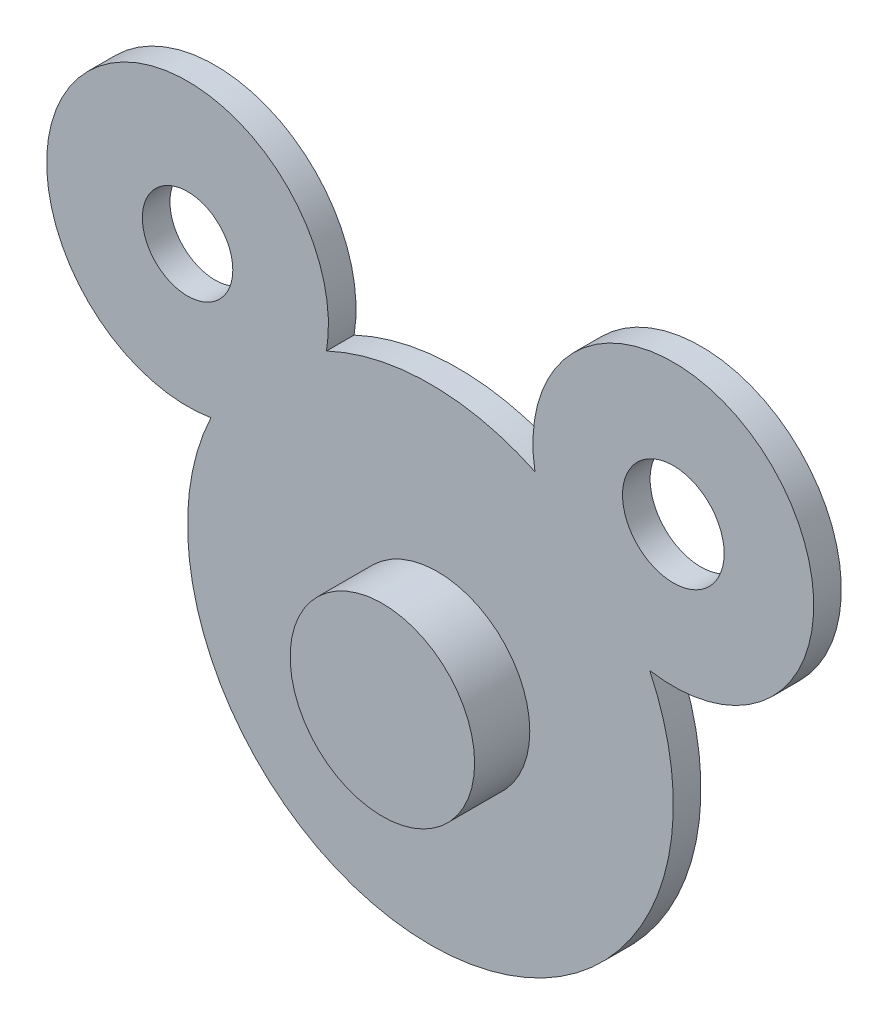
from build123d import *

# Parameters (mm, degrees)
SKETCH1_R           = 8.332963545
SKETCH1_R_2         = 9.35840883
BOSS_EXTRUDE2_DEPTH = 5.08
SKETCH2_R           = 16.987426911
BOSS_EXTRUDE3_DEPTH = 10.16
SKETCH2_3_R         = 7.512157001
CUT_EXTRUDE1_DEPTH  = 10.16
SKETCH2_4_R         = 16.987426911
SKETCH2_4_R_2       = 7.512157001
BOSS_EXTRUDE4_DEPTH = 10.16


with BuildPart() as part:
    # Sketch1 → Boss-Extrude2 (new body)
    with BuildSketch(Plane.XY):
        with BuildLine():
            ThreePointArc((-40.42750083, 19.142632152), (0.054998173, -44.730528326), (40.380305232, 19.241988943))
            ThreePointArc((40.380305232, 19.241988943), (63.014326775, 63.014326775), (19.241988943, 40.380305232))
            ThreePointArc((19.241988943, 40.380305232), (0.054998173, 44.730528326), (-19.142632152, 40.42750083))
            ThreePointArc((-19.142632152, 40.42750083), (-63.078021056, 63.078021056), (-40.42750083, 19.142632152))
        make_face()
        with Locations((-44.730562137, 44.730562137)):
            Circle(SKETCH1_R, mode=Mode.SUBTRACT)
        with Locations((44.730562137, 44.730562137)):
            Circle(SKETCH1_R_2, mode=Mode.SUBTRACT)
    extrude(amount=BOSS_EXTRUDE2_DEPTH)

    # Sketch2 → Boss-Extrude3 (add)
    with BuildSketch(Plane.XY.offset(5.08)):
        with Locations((1.305897397, -1.51434167)):
            Circle(SKETCH2_R)
    extrude(amount=BOSS_EXTRUDE3_DEPTH)

    # Sketch2<3> → Cut-Extrude1 (cut)
    with BuildSketch(Plane.XY.offset(5.08)):
        with Locations((1.305897397, -1.51434167)):
            Circle(SKETCH2_3_R)
    extrude(amount=-CUT_EXTRUDE1_DEPTH, mode=Mode.SUBTRACT)

    # Sketch2<4> → Boss-Extrude4 (add, through all)
    with BuildSketch(Plane.XY.offset(5.08)):
        with Locations((1.305897397, -1.51434167)):
            Circle(SKETCH2_4_R)
        with Locations((1.305897397, -1.51434167)):
            Circle(SKETCH2_4_R_2, mode=Mode.SUBTRACT)
    extrude(amount=BOSS_EXTRUDE4_DEPTH)


solid = part.part
